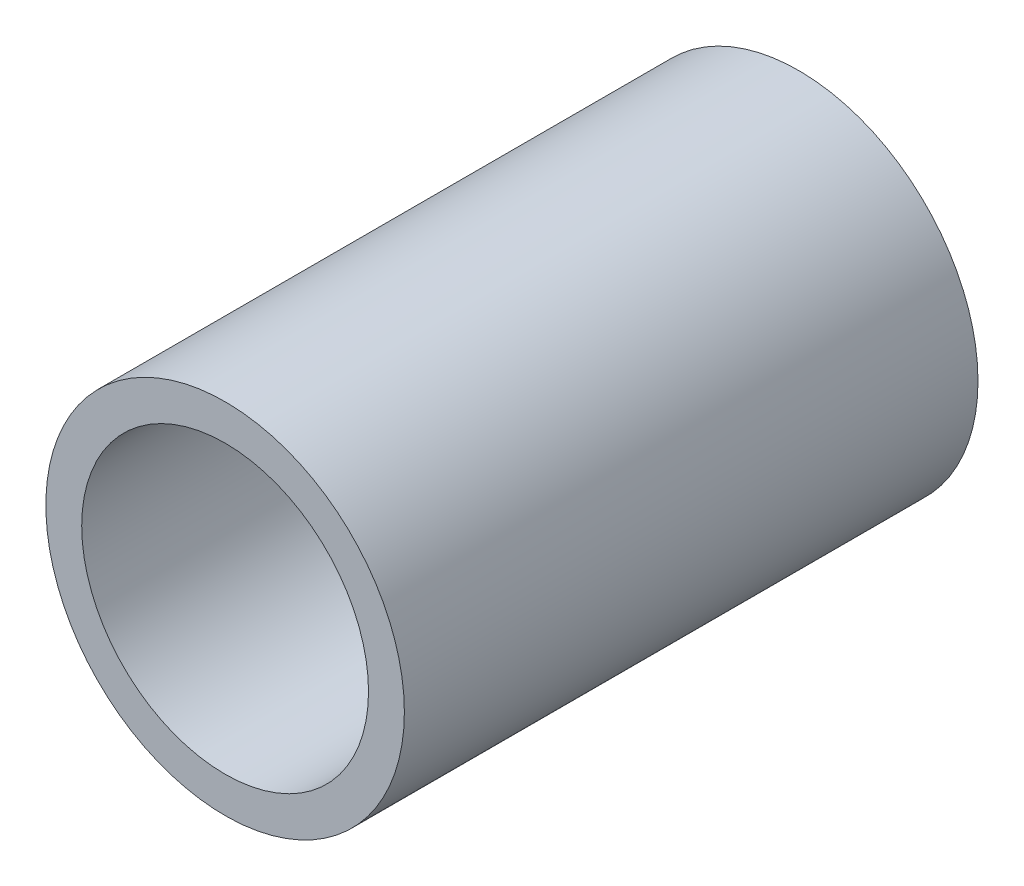
from build123d import *

# Parameters (mm, degrees)
SKETCH1_R           = 7.5
SKETCH1_R_2         = 6
BOSS_EXTRUDE1_DEPTH = 12


with BuildPart() as part:
    # Sketch1 → Boss-Extrude1 (new, symmetric)
    with BuildSketch(Plane.XY):
        Circle(SKETCH1_R)
        Circle(SKETCH1_R_2, mode=Mode.SUBTRACT)
    extrude(amount=BOSS_EXTRUDE1_DEPTH, both=True)


solid = part.part
